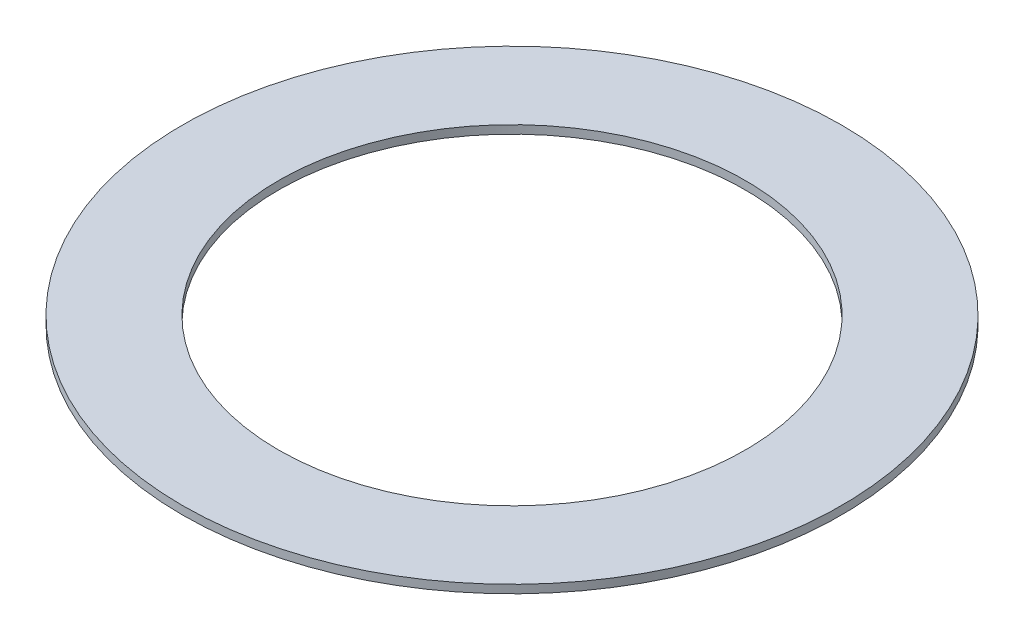
from build123d import *

# Parameters (mm, degrees)
SKETCH1_R           = 12
SKETCH1_R_2         = 8.5
BOSS_EXTRUDE1_DEPTH = 0.3


with BuildPart() as part:
    # Sketch1 → Boss-Extrude1 (new body)
    with BuildSketch(Plane(origin=(0, 0, 0), x_dir=(1, 0, 0), z_dir=(0, 1, 0))):
        with Locations(Location((0, 0, 0), (0, 0, 270))):
            Circle(SKETCH1_R)
        with Locations(Location((0, 0, 0), (0, 0, 270))):
            Circle(SKETCH1_R_2, mode=Mode.SUBTRACT)
    extrude(amount=BOSS_EXTRUDE1_DEPTH)


solid = part.part
